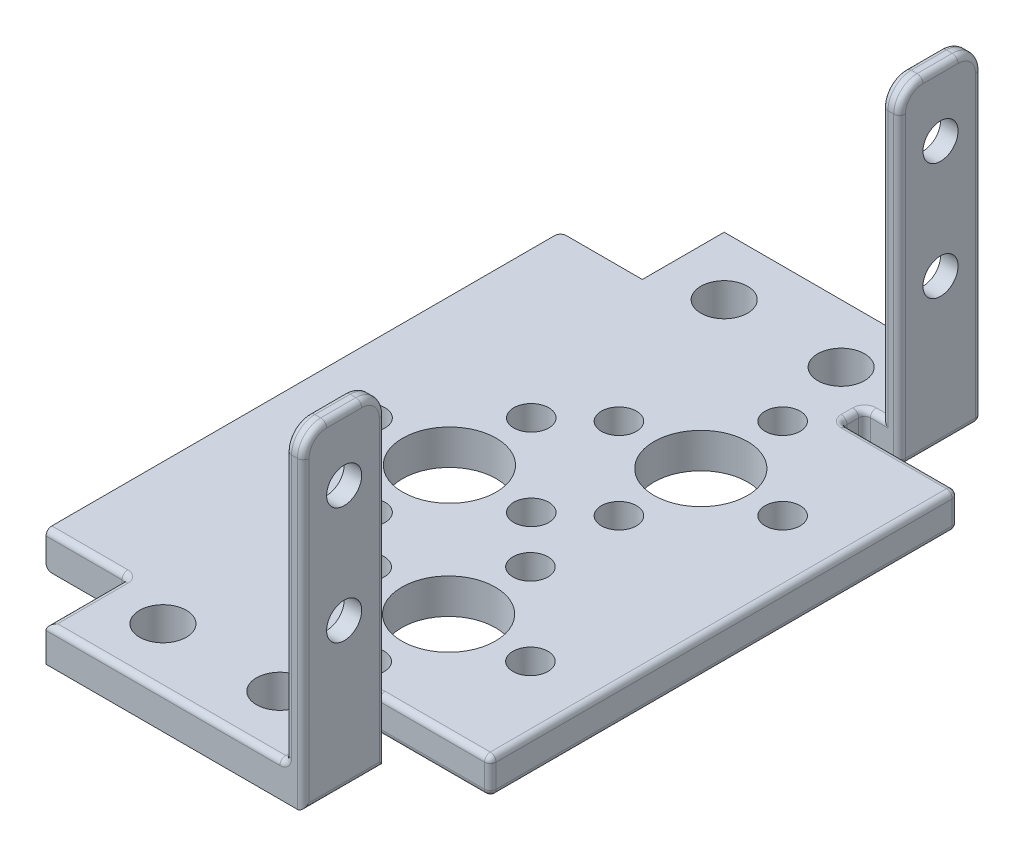
from build123d import *

# Parameters (mm, degrees)
BOSS_EXTRUDE1_DEPTH   = 3
SKETCH3_W             = 1.5
SKETCH3_H             = 7
BOSS_EXTRUDE2_DEPTH   = 25
FILLET3_R             = 2
FILLET4_R             = 0.5
F_8_0MM_DOWEL_HOLE1_D = 8
F_3_0MM_DOWEL_HOLE1_D = 3
F_4_0MM_DOWEL_HOLE1_D = 4
F_3_0MM_DOWEL_HOLE2_D = 3


with BuildPart() as part:
    # Sketch1 → Boss-Extrude1 (new body)
    with BuildSketch(Plane(origin=(0, 0, 0), x_dir=(1, 0, 0), z_dir=(0, 1, 0))):
        Polygon((11, 29), (-11, 29), (-11, 22), (-18, 22), (-18, -22), (-11, -22), (-11, -29), (11, -29), (11, -22), (8, -22), (8, -20), (18, -20), (18, 20), (8, 20), (8, 22), (11, 22), align=None)
    extrude(amount=BOSS_EXTRUDE1_DEPTH)

    # Sketch3 → Boss-Extrude2 (add)
    with BuildSketch(Plane(origin=(0, 3, 0), x_dir=(1, 0, 0), z_dir=(0, 1, 0))):
        with Locations((10.25, 25.5)):
            Rectangle(SKETCH3_W, SKETCH3_H)
        with Locations((10.25, -25.5)):
            Rectangle(SKETCH3_W, SKETCH3_H)
    extrude(amount=BOSS_EXTRUDE2_DEPTH)

    # Fillet3
    fillet3_edges = [part.edges().sort_by_distance(p)[0] for p in [
        (10.25, 28, -29),
        (10.25, 28, -22),
        (10.25, 28, 29),
        (10.25, 28, 22),
    ]]
    fillet(fillet3_edges, radius=FILLET3_R)

    # Fillet4
    fillet4_edges = [part.edges().sort_by_distance(p)[0] for p in [
        (13, 3, -20),
        (-14.5, 3, 22),
        (-0.75, 3, 29),
        (11, 27.414213562, -22.585786438),
        (11, 28, -25.5),
        (11, 27.414213562, -28.414213562),
        (9.5, 27.414213562, -28.414213562),
        (9.5, 28, -25.5),
        (9.5, 27.414213562, -22.585786438),
        (11, 27.414213562, 28.414213562),
        (11, 28, 25.5),
        (11, 27.414213562, 22.585786438),
        (9.5, 27.414213562, 28.414213562),
        (9.5, 28, 25.5),
        (9.5, 27.414213562, 22.585786438),
        (11, 0, 25.5),
        (18, 1.5, -20),
        (8, 1.5, -20),
        (8, 1.5, -22),
        (11, 13, -22),
        (11, 13, -29),
        (-18, 1.5, -22),
        (8.75, 3, -22),
        (8, 3, -21),
        (-14.5, 0, -22),
        (-11, 0, -25.5),
        (0, 0, -29),
        (11, 0, -25.5),
        (9.5, 0, -22),
        (8, 0, -21),
        (13, 0, -20),
        (9.5, 14.5, -29),
        (9.5, 14.5, -22),
        (-11, 1.5, 22),
        (11, 13, 29),
        (11, 13, 22),
        (8.75, 3, 22),
        (-11, 3, 25.5),
        (9.5, 14.5, 29),
        (9.5, 14.5, 22),
        (9.5, 3, 25.5),
        (8, 1.5, 20),
        (18, 1.5, 20),
        (13, 3, 20),
        (8, 3, 21),
        (13, 0, 20),
        (8, 0, 21),
        (18, 0, 0),
        (-18, 0, 0),
        (18, 3, 0),
    ]]
    fillet(fillet4_edges, radius=FILLET4_R)

    # Ø8.0mm Dowel Hole1 (through all)
    with Locations(Plane(origin=(0, 0, 0), x_dir=(-1, 0, 0), z_dir=(0, -1, 0))):
        with Locations((-5.5, -11.070444566), (-5.5, 10.5), (5.5, 0)):
            Hole(F_8_0MM_DOWEL_HOLE1_D / 2)

    # Ø3.0mm Dowel Hole1 (through all)
    with Locations(Plane(origin=(0, 0, 0), x_dir=(-1, 0, 0), z_dir=(0, -1, 0))):
        with Locations((5.5, 0), (5.5, -7), (-5.5, -11.070444566), (-5.5, -4.070444566), (-5.5, 3.5), (-5.5, 10.5), (-1.5, 0), (5.5, 7), (12.5, 0), (1.5, -11.070444566), (-5.5, -18.070444566), (-12.5, -11.070444566), (-12.5, 10.5), (-5.5, 17.5), (1.5, 10.5)):
            Hole(F_3_0MM_DOWEL_HOLE1_D / 2)

    # Ø4.0mm Dowel Hole1 (through all)
    with Locations(Plane(origin=(0, 0, 0), x_dir=(-1, 0, 0), z_dir=(0, -1, 0))):
        with Locations((-4, -24), (6, -24), (-4, 24), (6, 24)):
            Hole(F_4_0MM_DOWEL_HOLE1_D / 2)

    # Ø3.0mm Dowel Hole2 (through all)
    with Locations(Plane(origin=(11, 0, 0), x_dir=(0, 0, -1), z_dir=(1, 0, 0))):
        with Locations((25.5, 22.5), (25.5, 12.5), (-25.5, 12.5), (-25.5, 22.5)):
            Hole(F_3_0MM_DOWEL_HOLE2_D / 2)


solid = part.part
